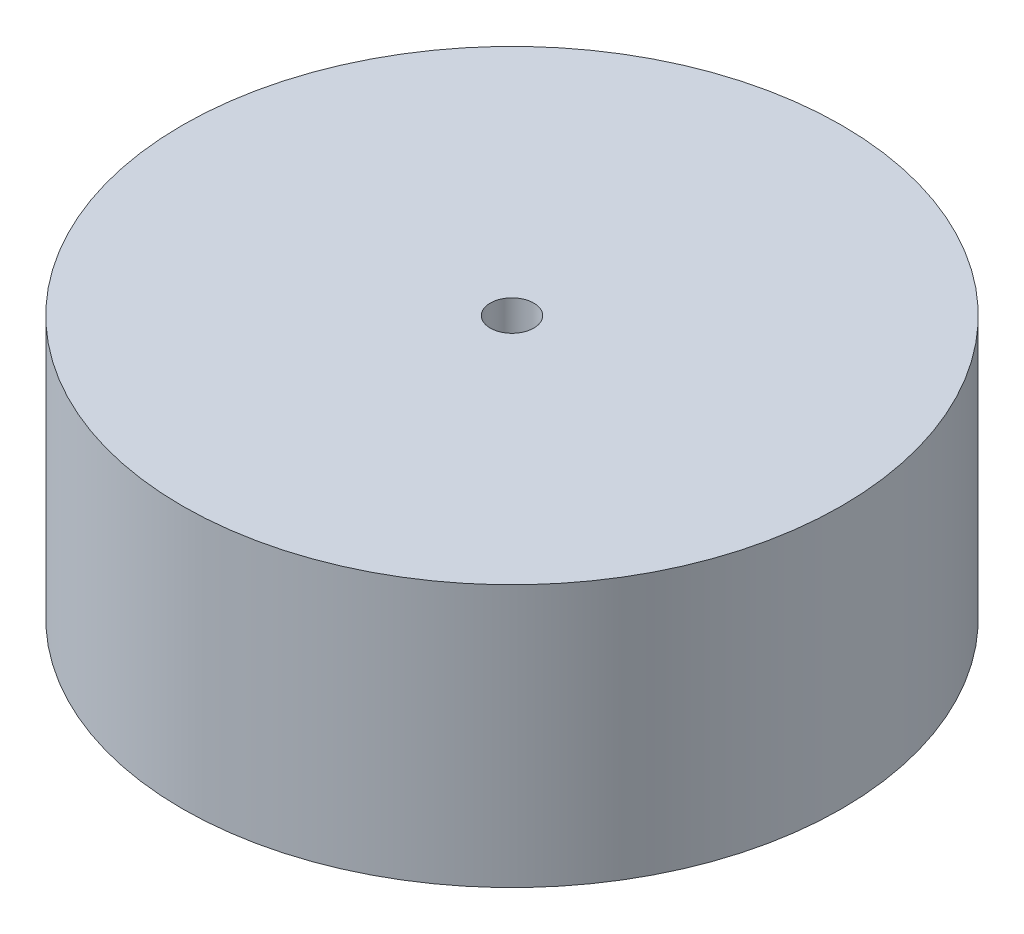
from build123d import *

# Parameters (mm, degrees)
SKETCH1_R           = 22
BOSS_EXTRUDE1_DEPTH = 17.5
CUT_EXTRUDE1_REACH  = 37.697
SKETCH2_R           = 1.45


with BuildPart() as part:
    # Sketch1 → Boss-Extrude1 (new body)
    with BuildSketch(Plane(origin=(0, 0, 0), x_dir=(1, 0, 0), z_dir=(0, 1, 0))):
        with Locations(Location((0, 0, 0), (0, 0, 270))):
            Circle(SKETCH1_R)
    extrude(amount=BOSS_EXTRUDE1_DEPTH)

    # Sketch2 → Cut-Extrude1 (cut, up to next)
    with BuildSketch(Plane(origin=(0, 17.5, 0), x_dir=(1, 0, 0), z_dir=(0, 1, 0)), mode=Mode.PRIVATE) as cut_extrude1_sk1:
        with Locations(Location((0, 0, 0), (0, 0, 270))):
            Circle(SKETCH2_R)
    cut_extrude1_tool1 = extrude(cut_extrude1_sk1.sketch, amount=-CUT_EXTRUDE1_REACH, mode=Mode.PRIVATE) & part.part
    add(cut_extrude1_tool1.solids().sort_by_distance((0, 17.5, 0))[0], mode=Mode.SUBTRACT)


solid = part.part
